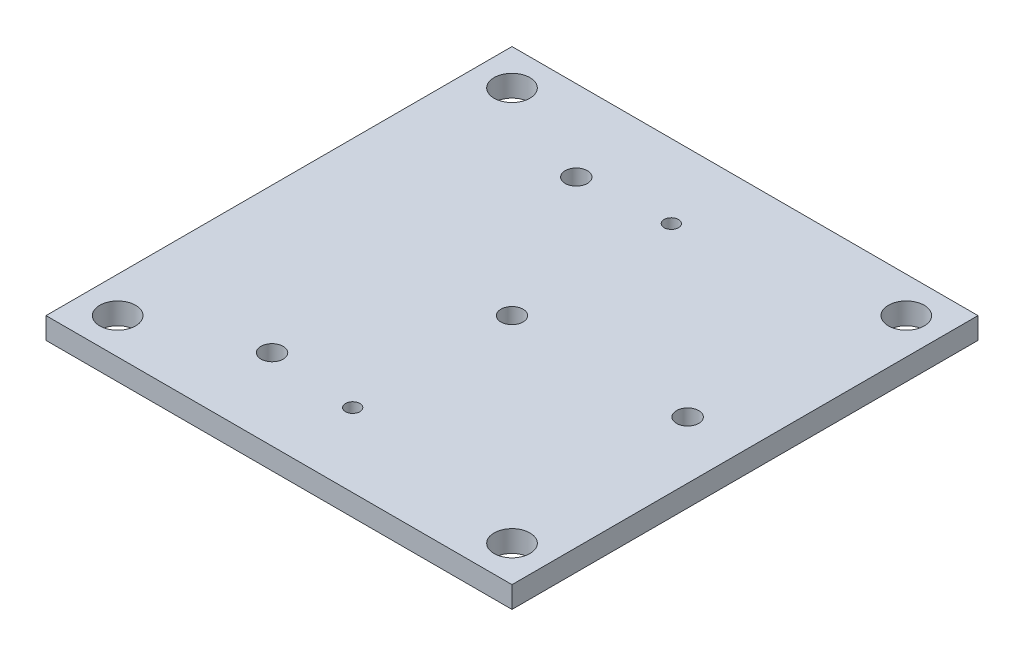
from build123d import *

# Parameters (mm, degrees)
SKETCH_8_R          = 58
SKETCH_8_R_2        = 3
EXTRUDE_5_DEPTH     = 6
SKETCH_9_R          = 2
EXTRUDE_6_DEPTH     = 12
EXTRUDE_START       = -6
SKETCH_10_W         = 130
SKETCH_10_H         = 130
SKETCH_10_R         = 5
SKETCH_10_R_2       = 58
EXTRUDE_8_DEPTH     = 6
CUT_EXTRUDE_START   = -30
SKETCH_12_R         = 2
CUT_EXTRUDE_1_DEPTH = 30
SKETCH_13_R         = 2
CUT_EXTRUDE_2_DEPTH = 30
SKETCH_14_R         = 3.1
CUT_EXTRUDE_3_DEPTH = 6
SKETCH_15_R         = 3.1
CUT_EXTRUDE_4_DEPTH = 6


with BuildPart() as part:
    # 草图8 → 凸台-拉伸5 (new body)
    with BuildSketch(Plane.XZ.offset(-1803)):
        with Locations(Location((2814.779756067, -929.5, 0), (0, 0, 270))):
            Circle(SKETCH_8_R)
        with Locations(Location((2814.779756067, -929.5, 0), (0, 0, 270))):
            Circle(SKETCH_8_R_2, mode=Mode.SUBTRACT)
    extrude(amount=EXTRUDE_5_DEPTH)

    # 草图9 → 凸台-拉伸6 (add)
    with BuildSketch(Plane.XZ.offset(-1797)):
        with Locations(Location((2814.779756067, -885.05, 0), (0, 0, 270))):
            Circle(SKETCH_9_R)
        with Locations(Location((2814.779756067, -973.95, 0), (0, 0, 270))):
            Circle(SKETCH_9_R)
    extrude(amount=-EXTRUDE_6_DEPTH)

    # 草图10 → 凸台-拉伸8 (add)
    with BuildSketch(Plane.XZ.offset(-1797).offset(EXTRUDE_START)):
        with Locations((2814.779756067, -929.5)):
            Rectangle(SKETCH_10_W, SKETCH_10_H)
        with Locations(Location((2869.779756067, -984.5, 0), (0, 0, 270))):
            Circle(SKETCH_10_R, mode=Mode.SUBTRACT)
        with Locations(Location((2759.779756067, -984.5, 0), (0, 0, 270))):
            Circle(SKETCH_10_R, mode=Mode.SUBTRACT)
        with Locations(Location((2759.779756067, -874.5, 0), (0, 0, 270))):
            Circle(SKETCH_10_R, mode=Mode.SUBTRACT)
        with Locations(Location((2869.779756067, -874.5, 0), (0, 0, 270))):
            Circle(SKETCH_10_R, mode=Mode.SUBTRACT)
        with Locations((2814.779756067, -929.5)):
            Circle(SKETCH_10_R_2, mode=Mode.SUBTRACT)
    extrude(amount=EXTRUDE_8_DEPTH)

    # 草图12 → 切除-拉伸1 (cut)
    with BuildSketch(Plane(origin=(0, 1809, 0), x_dir=(1, 0, 0), z_dir=(0, 1, 0)).offset(CUT_EXTRUDE_START)):
        with Locations(Location((2814.779756067, 973.95, 0), (0, 0, 90))):
            Circle(SKETCH_12_R)
    extrude(amount=CUT_EXTRUDE_1_DEPTH, mode=Mode.SUBTRACT)

    # 草图13 → 切除-拉伸2 (cut)
    with BuildSketch(Plane(origin=(0, 1809, 0), x_dir=(1, 0, 0), z_dir=(0, 1, 0)).offset(CUT_EXTRUDE_START)):
        with Locations(Location((2814.779756067, 885.05, 0), (0, 0, 90))):
            Circle(SKETCH_13_R)
    extrude(amount=CUT_EXTRUDE_2_DEPTH, mode=Mode.SUBTRACT)

    # 草图14 → 切除-拉伸3 (cut)
    with BuildSketch(Plane(origin=(0, 1803, 0), x_dir=(1, 0, 0), z_dir=(0, 1, 0))):
        with Locations(Location((2814.779756067, 929.5, 0), (0, 0, 270))):
            Circle(SKETCH_14_R)
    extrude(amount=-CUT_EXTRUDE_3_DEPTH, mode=Mode.SUBTRACT)

    # 草图15 → 切除-拉伸4 (cut)
    with BuildSketch(Plane(origin=(0, 1803, 0), x_dir=(1, 0, 0), z_dir=(0, 1, 0))):
        with Locations(Location((2863.779756067, 929.5, 0), (0, 0, 270))):
            Circle(SKETCH_15_R)
        with Locations(Location((2790.279756067, 887.064755215, 0), (0, 0, 270))):
            Circle(SKETCH_15_R)
        with Locations(Location((2790.279756067, 971.935244785, 0), (0, 0, 270))):
            Circle(SKETCH_15_R)
    extrude(amount=-CUT_EXTRUDE_4_DEPTH, mode=Mode.SUBTRACT)


solid = part.part
